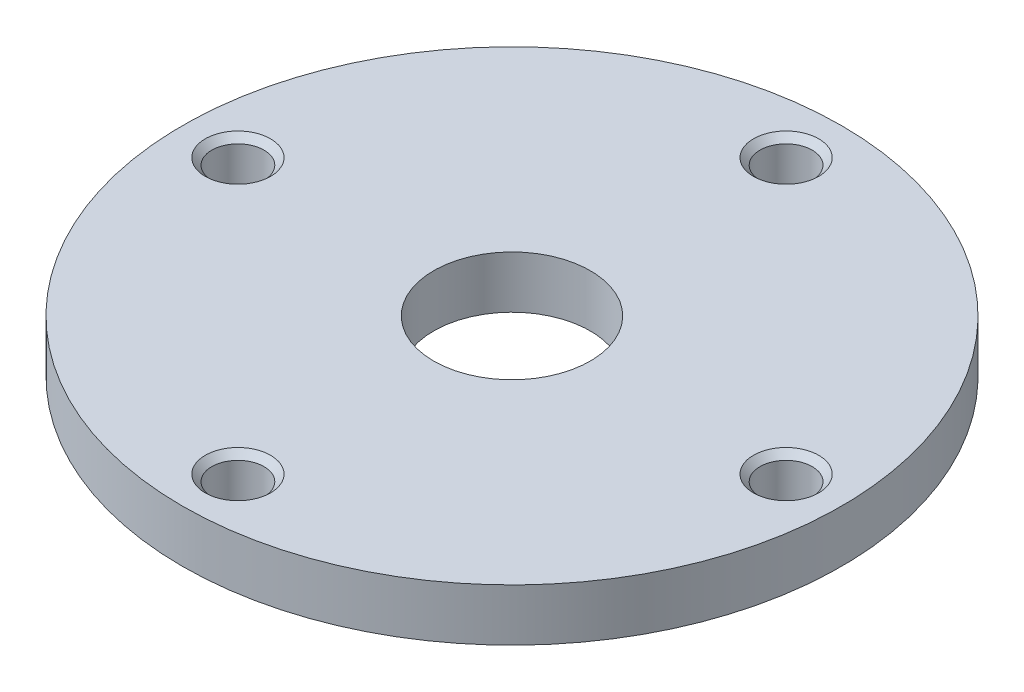
from build123d import *

# Parameters (mm, degrees)
SKETCH1_R             = 12.625
BOSS_EXTRUDE1_DEPTH   = 2
SKETCH2_R             = 0.5
CUT_EXTRUDE1_DEPTH    = 18.966113937
F_2_0MM_DOWEL_HOLE1_D = 2
CHAMFER1_SIZE         = 0.25
SKETCH4_R             = 3
CUT_EXTRUDE2_DEPTH    = 10


with BuildPart() as part:
    # Sketch1 → Boss-Extrude1 (new body)
    with BuildSketch(Plane(origin=(0, 0, 0), x_dir=(1, 0, 0), z_dir=(0, 1, 0))):
        with Locations(Location((0, 0, 0), (0, 0, 270))):
            Circle(SKETCH1_R)
    extrude(amount=BOSS_EXTRUDE1_DEPTH)

    # Sketch2 → Cut-Extrude1 (cut, through all)
    with BuildSketch(Plane(origin=(0, 2, 0), x_dir=(1, 0, 0), z_dir=(0, 1, 0))):
        with Locations(Location((0, 10.5, 0), (0, 0, 270))):
            Circle(SKETCH2_R)
        with Locations(Location((10.5, 0, 0), (0, 0, 270))):
            Circle(SKETCH2_R)
        with Locations(Location((0, -10.5, 0), (0, 0, 270))):
            Circle(SKETCH2_R)
        with Locations(Location((-10.5, 0, 0), (0, 0, 270))):
            Circle(SKETCH2_R)
    extrude(amount=-CUT_EXTRUDE1_DEPTH, mode=Mode.SUBTRACT)

    # Ø2.0mm Dowel Hole1 (through all)
    with Locations(Plane(origin=(-10.5, 2, 0), x_dir=(0, 0, 1), z_dir=(0, 1, 0))):
        with Locations((0, 0), (-10.5, 10.5), (0, 21), (10.5, 10.5)):
            Hole(F_2_0MM_DOWEL_HOLE1_D / 2)

    # Chamfer1
    chamfer1_edges = [part.edges().sort_by_distance(p)[0] for p in [
        (0, 2, 11.5),
        (10.5, 2, 1),
        (0, 2, -9.5),
        (-10.5, 2, 1),
    ]]
    chamfer(chamfer1_edges, length=CHAMFER1_SIZE)

    # Sketch4 → Cut-Extrude2 (cut)
    with BuildSketch(Plane(origin=(0, 2, 0), x_dir=(1, 0, 0), z_dir=(0, 1, 0))):
        with Locations(Location((0, 0, 0), (0, 0, 270))):
            Circle(SKETCH4_R)
    extrude(amount=-CUT_EXTRUDE2_DEPTH, mode=Mode.SUBTRACT)


solid = part.part
